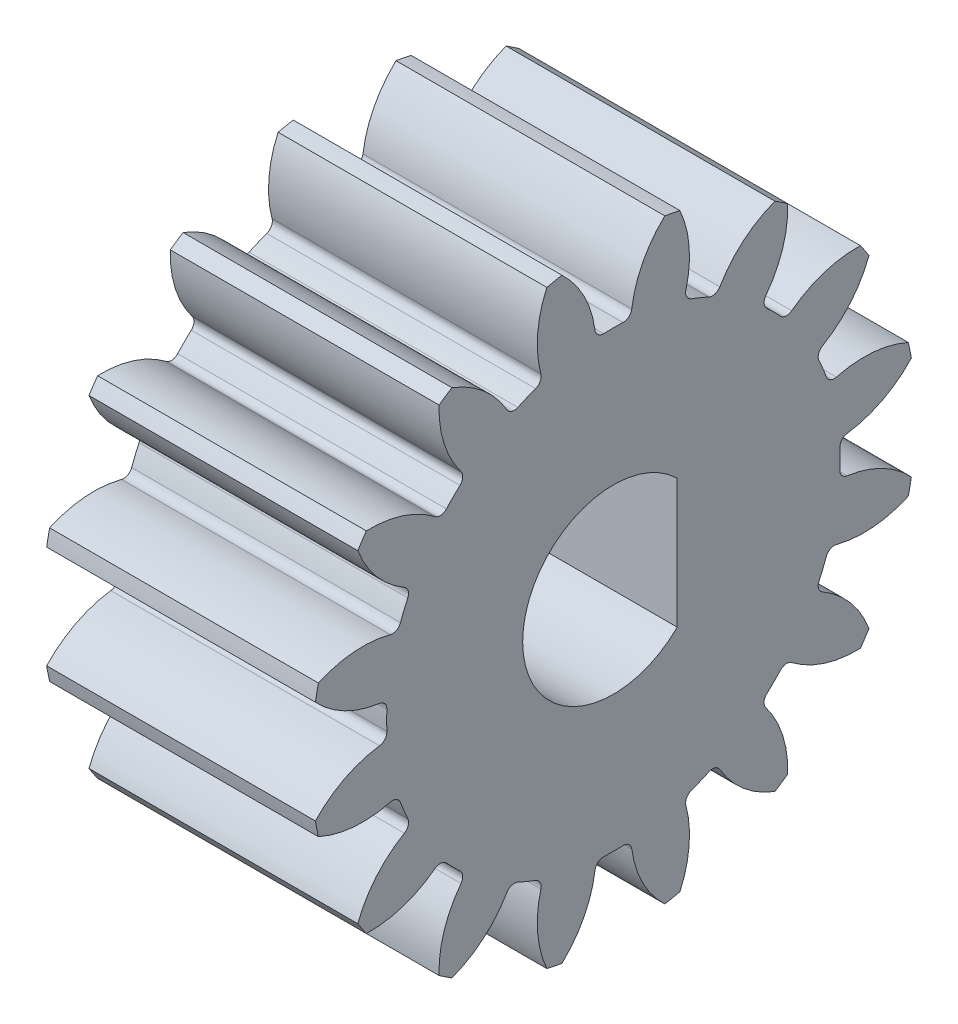
from build123d import *

# Parameters (mm, degrees)
BASPROSKE_W                = 4
BASPROSKE_H                = 4.5
TOOTHCUT_DEPTH             = 8.516648189
ROOTFILLETS_R              = 0.126
TEETHCUTS_COUNT            = 16
ROOTFILLETS_OF_TEETHCUTS_R = 0.126
SHAFTHOLE_DEPTH            = 8.438389391
SCREWHOLESKE_R             = 0.425
SCREWHOLE_DEPTH            = 9.041000726


with BuildPart() as part:
    # BasProSke → Base-Revolve (revolve)
    with BuildSketch(Plane(origin=(0, 0, 0), x_dir=(1, 0, 0), z_dir=(0, 1, 0)), mode=Mode.PRIVATE) as base_revolve_sk:
        with Locations((2, 2.25)):
            Rectangle(BASPROSKE_W, BASPROSKE_H)
    revolve(base_revolve_sk.sketch.rotate(Axis((-10, 0, 0), (1, 0, 0)), 180), axis=Axis((-10, 0, 0), (1, 0, 0)))

    # TooCutSke → ToothCut (cut, through all)
    with BuildSketch(Plane(origin=(0, 0, 0), x_dir=(0, 0, -1), z_dir=(1, 0, 0))):
        with BuildLine():
            ThreePointArc((0.261866103, 3.363822549), (0, 3.374), (-0.261866103, 3.363822549))
            ThreePointArc((-0.261866103, 3.363822549), (-0.417714668, 3.961827375), (-0.788562282, 4.456165918))
            ThreePointArc((-0.788562282, 4.456165918), (0, 4.5254), (0.788562282, 4.456165918))
            ThreePointArc((0.788562282, 4.456165918), (0.417714668, 3.961827375), (0.261866103, 3.363822549))
        make_face()
    toothcut = extrude(amount=TOOTHCUT_DEPTH, mode=Mode.SUBTRACT)

    # RootFillets
    rootfillets_edges = [part.edges().sort_by_distance(p)[0] for p in [
        (2, 3.363822549, -0.261866103),
        (2, 3.363822549, 0.261866103),
    ]]
    fillet(rootfillets_edges, radius=ROOTFILLETS_R)

    # TeethCuts: ToothCut ×16 about axis
    teethcuts_axis = Axis((0, 0, 0), (1, 0, 0))
    for i in range(1, TEETHCUTS_COUNT):
        add(toothcut.rotate(teethcuts_axis, i * 360 / TEETHCUTS_COUNT), mode=Mode.SUBTRACT)

    # RootFillets of TeethCuts
    rootfillets_of_teethcuts_edges = [part.edges().sort_by_distance(p)[0] for p in [
        (2, 3.207978624, 1.045346426),
        (2, 3.007554985, 1.529211892),
        (2, 2.563749033, 2.193414438),
        (2, 2.193414438, 2.563749033),
        (2, 1.529211892, 3.007554985),
        (2, 1.045346426, 3.207978624),
        (2, 0.261866103, 3.363822549),
        (2, -0.261866103, 3.363822549),
        (2, -1.045346426, 3.207978624),
        (2, -1.529211892, 3.007554985),
        (2, -2.193414438, 2.563749033),
        (2, -2.563749033, 2.193414438),
        (2, -3.007554985, 1.529211892),
        (2, -3.207978624, 1.045346426),
        (2, -3.363822549, 0.261866103),
        (2, -3.363822549, -0.261866103),
        (2, -3.207978624, -1.045346426),
        (2, -3.007554985, -1.529211892),
        (2, -2.563749033, -2.193414438),
        (2, -2.193414438, -2.563749033),
        (2, -1.529211892, -3.007554985),
        (2, -1.045346426, -3.207978624),
        (2, -0.261866103, -3.363822549),
        (2, 0.261866103, -3.363822549),
        (2, 1.045346426, -3.207978624),
        (2, 1.529211892, -3.007554985),
        (2, 2.193414438, -2.563749033),
        (2, 2.563749033, -2.193414438),
        (2, 3.007554985, -1.529211892),
        (2, 3.207978624, -1.045346426),
    ]]
    fillet(rootfillets_of_teethcuts_edges, radius=ROOTFILLETS_OF_TEETHCUTS_R)

    # ShaftHoleSke → ShaftHole (cut, through all)
    with BuildSketch(Plane(origin=(4, 0, 0), x_dir=(0, 0, -1), z_dir=(1, 0, 0))):
        with BuildLine():
            Line((0.95, -0.959166305), (0.95, 0.959166305))
            ThreePointArc((0.95, 0.959166305), (-1.35, 0), (0.95, -0.959166305))
        make_face()
    extrude(amount=-SHAFTHOLE_DEPTH, mode=Mode.SUBTRACT)

    # ScrewHoleSke → ScrewHole (cut, through all)
    with BuildSketch(Plane.XY.offset(-0.95)):
        with Locations((2, 0)):
            Circle(SCREWHOLESKE_R)
    extrude(amount=-SCREWHOLE_DEPTH, mode=Mode.SUBTRACT)


solid = part.part
